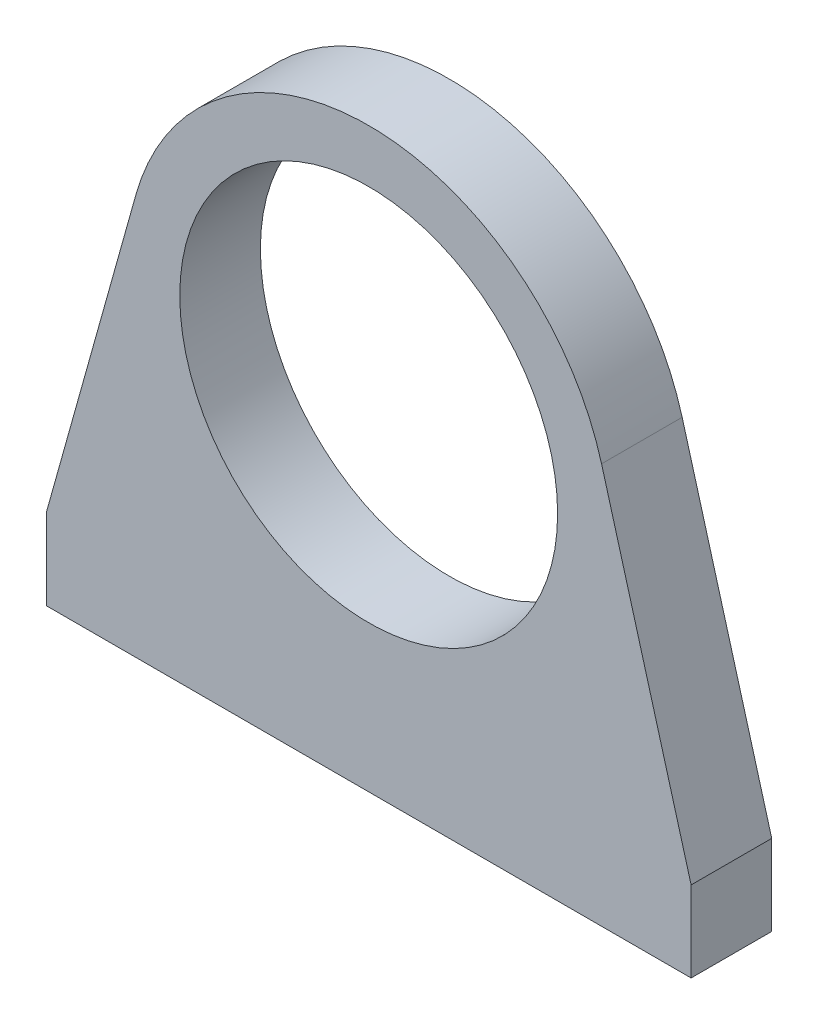
from build123d import *

# Parameters (mm, degrees)
BOSS_EXTRUDE1_DEPTH           = 6.35
F_1_1_4_12_TAPPED_HOLE1_D     = 29.76626
F_1_1_4_12_TAPPED_HOLE1_DEPTH = 74.0791
F_1_1_4_12_TAPPED_HOLE1_TIP   = 8.942686705


with BuildPart() as part:
    # Sketch1 → Boss-Extrude1 (new body)
    with BuildSketch(Plane.XY):
        with BuildLine():
            Line((0, 0), (-25.4, 0))
            Line((-25.4, 0), (-25.4, 6.35))
            Line((-25.4, 6.35), (-18.344682017, 31.55167344))
            ThreePointArc((-18.344682017, 31.55167344), (0, 45.466), (18.344682017, 31.55167344))
            Line((18.344682017, 31.55167344), (25.4, 6.35))
            Line((25.4, 6.35), (25.4, 0))
            Line((25.4, 0), (0, 0))
        make_face()
    extrude(amount=BOSS_EXTRUDE1_DEPTH)

    # 1-1/4-12 Tapped Hole1
    with Locations(Plane(origin=(0, 26.416, 6.35), x_dir=(1, 0, 0), z_dir=(0, 0, 1))):
        with Locations((0, 0)):
            Hole(F_1_1_4_12_TAPPED_HOLE1_D / 2, depth=F_1_1_4_12_TAPPED_HOLE1_DEPTH)
            with Locations((0, 0, -(F_1_1_4_12_TAPPED_HOLE1_DEPTH + F_1_1_4_12_TAPPED_HOLE1_TIP / 2))):  # 118° drill point
                Cone(0, F_1_1_4_12_TAPPED_HOLE1_D / 2, F_1_1_4_12_TAPPED_HOLE1_TIP, mode=Mode.SUBTRACT)


solid = part.part
